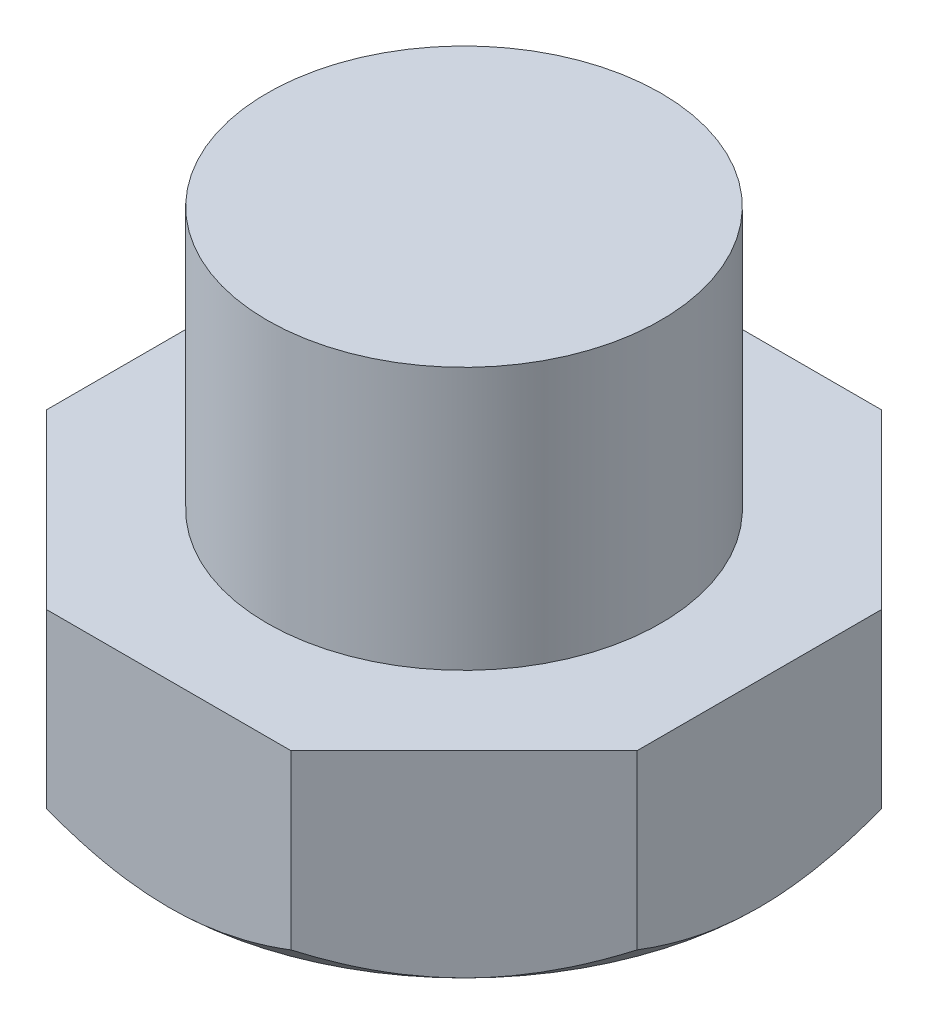
from build123d import *

# Parameters (mm, degrees)
SKETCH1_R           = 15
BOSS_EXTRUDE1_DEPTH = 20
BOSS_EXTRUDE2_DEPTH = 15
SKETCH3_OUTSIDE_W   = 101.526
SKETCH3_OUTSIDE_H   = 101.526
SKETCH3_OUTSIDE_R   = 22.5
CUT_EXTRUDE1_DEPTH  = 20
CUT_EXTRUDE1_DRAFT  = -45


with BuildPart() as part:
    # Sketch1 → Boss-Extrude1 (new body)
    with BuildSketch(Plane(origin=(0, 0, 0), x_dir=(1, 0, 0), z_dir=(0, 1, 0))):
        with Locations(Location((0, 0, 0), (0, 0, 270))):
            Circle(SKETCH1_R)
    extrude(amount=BOSS_EXTRUDE1_DEPTH)

    # Sketch2 → Boss-Extrude2 (add)
    with BuildSketch(Plane.XZ):
        Polygon((22.5, -9.319805153), (22.5, 9.319805153), (9.319805153, 22.5), (-9.319805153, 22.5), (-22.5, 9.319805153), (-22.5, -9.319805153), (-9.319805153, -22.5), (9.319805153, -22.5), align=None)
    extrude(amount=BOSS_EXTRUDE2_DEPTH)


with BuildPart() as cut_extrude1_tool:
    # Sketch3 outside → Cut-Extrude1 (with draft: the straight prism first)
    with BuildSketch(Plane(origin=(0, -15, 0), x_dir=(-1, 0, 0), z_dir=(0, -1, 0))):
        Rectangle(SKETCH3_OUTSIDE_W, SKETCH3_OUTSIDE_H)
        Circle(SKETCH3_OUTSIDE_R, mode=Mode.SUBTRACT)
    extrude(amount=-CUT_EXTRUDE1_DEPTH)
    # Cut-Extrude1: the draft: its side faces are tilted about the plane it starts from
    cut_extrude1_sides = [cut_extrude1_tool.faces().sort_by_distance(p)[0] for p in [
        (0, -5, 50.763),
        (-50.763, -5, 0),
        (0, -5, -50.763),
        (50.763, -5, 0),
        (22.5, -5, 0),
    ]]
    draft(cut_extrude1_sides, Plane(origin=(0, -15, 0), x_dir=(-1, 0, 0), z_dir=(0, -1, 0)), CUT_EXTRUDE1_DRAFT)


with BuildPart() as part_1:
    add(part.part)

    # Cut-Extrude1: cut by cut_extrude1_tool
    add(cut_extrude1_tool.part, mode=Mode.SUBTRACT)


solid = part_1.part
